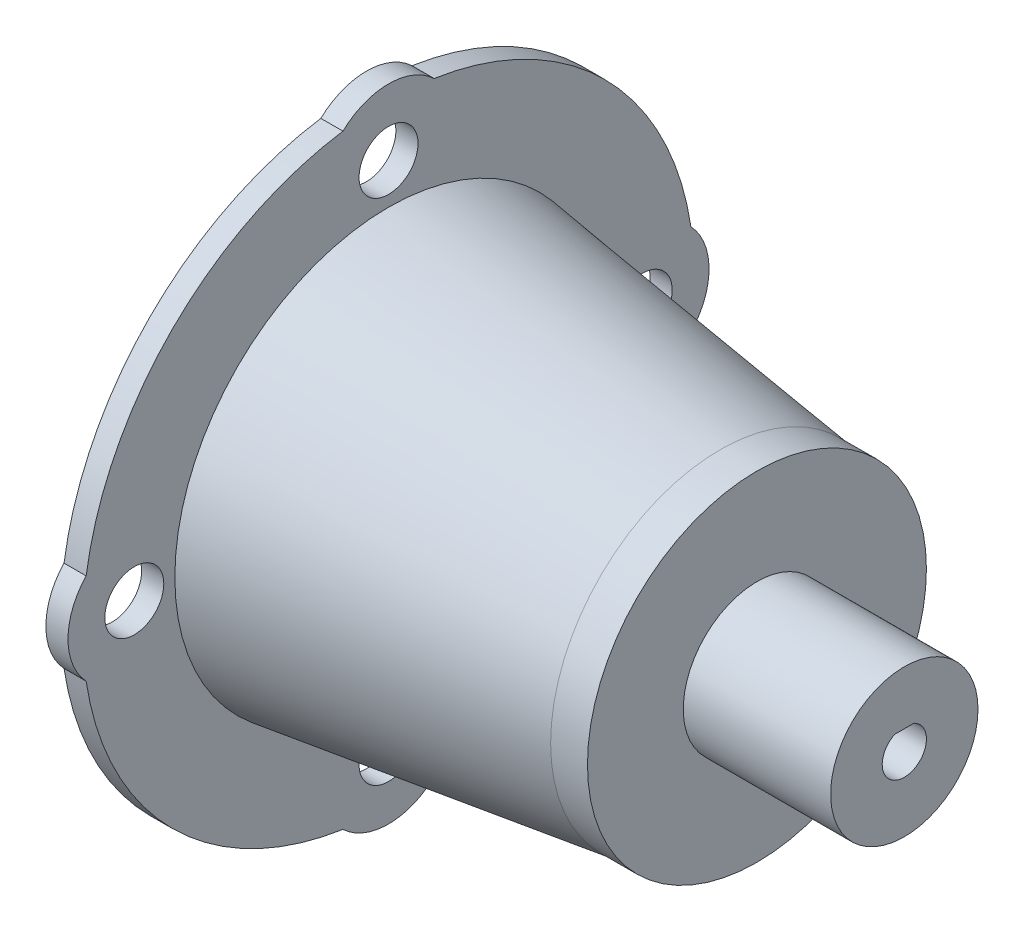
from build123d import *

# Parameters (mm, degrees)
CROQUIS1_R              = 4
CROQUIS1_R_2            = 20
SALIENTE_EXTRUIR1_DEPTH = 3
CROQUIS2_R              = 23
CROQUIS2_R_2            = 20
EXTRUIR_L_MINA2_DEPTH   = 30
CROQUIS3_R              = 23
SALIENTE_EXTRUIR2_DEPTH = 20
CROQUIS4_R              = 4.4
SALIENTE_EXTRUIR3_DEPTH = 20
CROQUIS6_R              = 10
SALIENTE_EXTRUIR4_DEPTH = 20


with BuildPart() as part:
    # Croquis1 → Saliente-Extruir1 (new body)
    with BuildSketch(Plane(origin=(0, 0, 0), x_dir=(0, 0, -1), z_dir=(1, 0, 0))):
        with BuildLine():
            ThreePointArc((6.186895244, 41.036231884), (0, 43.5), (-6.186895244, 41.036231884))
            ThreePointArc((-6.186895244, 41.036231884), (-29.344931419, 29.344931419), (-41.036231884, 6.186895244))
            ThreePointArc((-41.036231884, 6.186895244), (-43.5, 0), (-41.036231884, -6.186895244))
            ThreePointArc((-41.036231884, -6.186895244), (-29.344931419, -29.344931419), (-6.186895244, -41.036231884))
            ThreePointArc((-6.186895244, -41.036231884), (0, -43.5), (6.186895244, -41.036231884))
            ThreePointArc((6.186895244, -41.036231884), (29.344931419, -29.344931419), (41.036231884, -6.186895244))
            ThreePointArc((41.036231884, -6.186895244), (43.5, 0), (41.036231884, 6.186895244))
            ThreePointArc((41.036231884, 6.186895244), (29.344931419, 29.344931419), (6.186895244, 41.036231884))
        make_face()
        with Locations((0, -34.5)):
            Circle(CROQUIS1_R, mode=Mode.SUBTRACT)
        with Locations((-34.5, 0)):
            Circle(CROQUIS1_R, mode=Mode.SUBTRACT)
        Circle(CROQUIS1_R_2, mode=Mode.SUBTRACT)
        with Locations((0, 34.5)):
            Circle(CROQUIS1_R, mode=Mode.SUBTRACT)
        with Locations((34.5, 0)):
            Circle(CROQUIS1_R, mode=Mode.SUBTRACT)
    extrude(amount=SALIENTE_EXTRUIR1_DEPTH)

    # Croquis2 → Extruir-Lámina2 (add)
    with BuildSketch(Plane(origin=(3, 0, 0), x_dir=(0, 0, -1), z_dir=(1, 0, 0))):
        Circle(CROQUIS2_R)
        Circle(CROQUIS2_R_2, mode=Mode.SUBTRACT)
    extrude(amount=EXTRUIR_L_MINA2_DEPTH)

    # Croquis3 → Saliente-Extruir2 (add)
    with BuildSketch(Plane(origin=(33, 0, 0), x_dir=(0, 0, -1), z_dir=(1, 0, 0))):
        Circle(CROQUIS3_R)
    extrude(amount=SALIENTE_EXTRUIR2_DEPTH)

    # Croquis4 → Saliente-Extruir3 (add)
    with BuildSketch(Plane.ZY.offset(-33)):
        with Locations(Location((0, 0, 0), (0, 0, 180))):
            Circle(CROQUIS4_R)
    extrude(amount=SALIENTE_EXTRUIR3_DEPTH)

    # Croquis5 → Revolución1 (revolve)
    with BuildSketch(Plane(origin=(0, 0, 0), x_dir=(1, 0, 0), z_dir=(0, 1, 0))):
        Polygon((48, -23), (3, -29), (3, -23), align=None)
    revolve(axis=Axis((-12.262234232, 0, 0), (1, 0, 0)))

    # Croquis6 → Saliente-Extruir4 (add)
    with BuildSketch(Plane(origin=(53, 0, 0), x_dir=(0, 0, -1), z_dir=(1, 0, 0))):
        Circle(CROQUIS6_R)
        with BuildLine():
            Line((-1.307669683, 2.7), (1.307669683, 2.7))
            ThreePointArc((1.307669683, 2.7), (0, -3), (-1.307669683, 2.7))
        make_face(mode=Mode.SUBTRACT)
    extrude(amount=SALIENTE_EXTRUIR4_DEPTH)


solid = part.part
